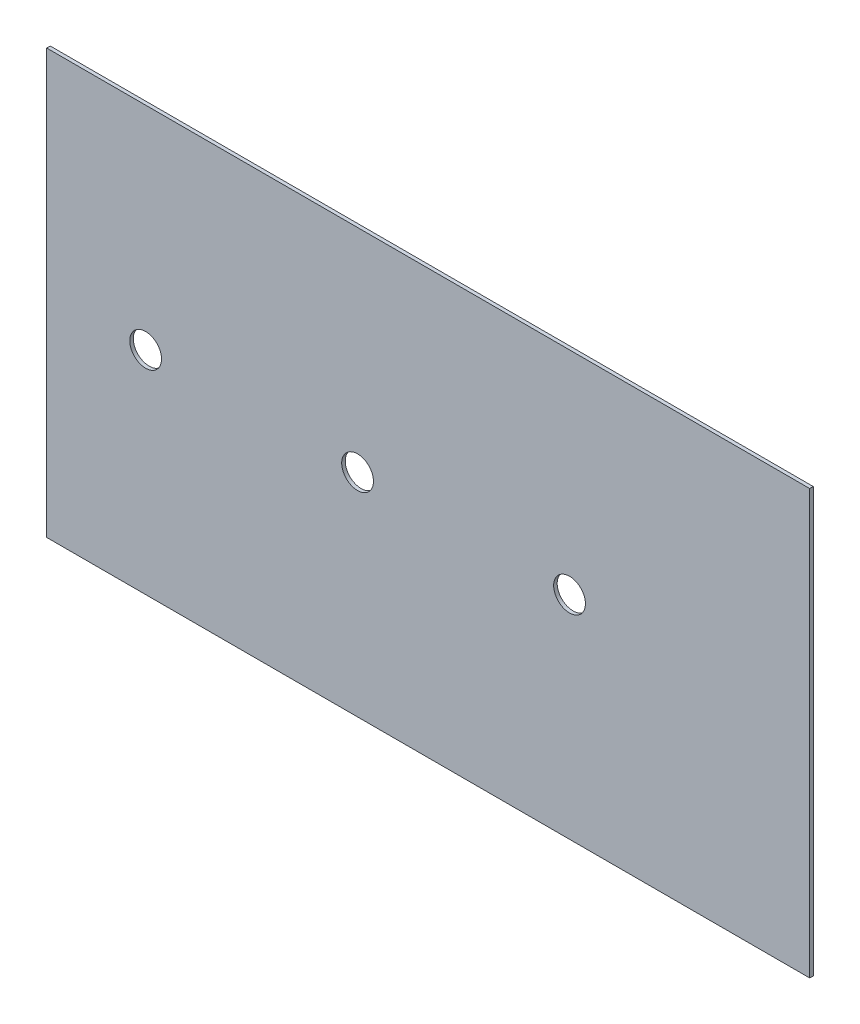
from build123d import *

# Parameters (mm, degrees)
SKETCH1_W           = 685.8
SKETCH1_H           = 381
BOSS_EXTRUDE1_DEPTH = 3.175
SKETCH2_R           = 14.2875
CUT_EXTRUDE1_DEPTH  = 785.533441368


with BuildPart() as part:
    # Sketch1 → Boss-Extrude1 (new body)
    with BuildSketch(Plane.XY):
        with Locations((342.9, 190.5)):
            Rectangle(SKETCH1_W, SKETCH1_H)
    extrude(amount=BOSS_EXTRUDE1_DEPTH)

    # Sketch2 → Cut-Extrude1 (cut, through all)
    with BuildSketch(Plane.XY.offset(3.175)):
        with Locations((469.9, 190.5)):
            Circle(SKETCH2_R)
        with Locations((88.9, 190.5)):
            Circle(SKETCH2_R)
        with Locations((279.4, 190.5)):
            Circle(SKETCH2_R)
    extrude(amount=-CUT_EXTRUDE1_DEPTH, mode=Mode.SUBTRACT)


solid = part.part
